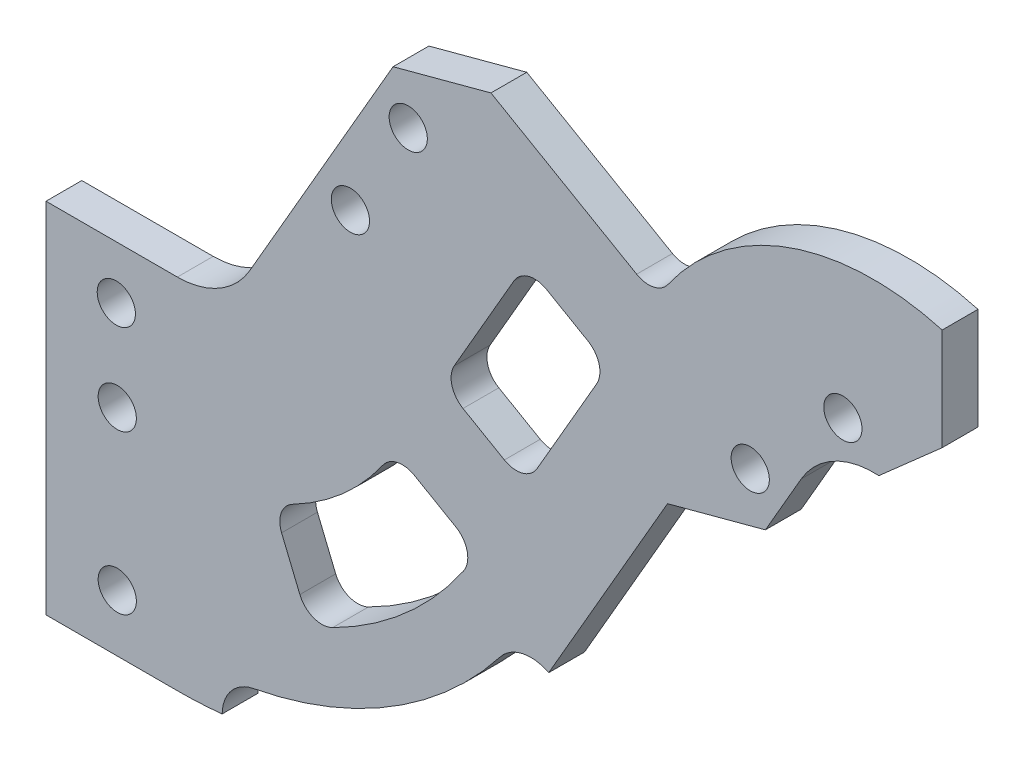
from build123d import *

# Parameters (mm, degrees)
SKETCH1_R          = 1.6
EXTRUDE1_DEPTH     = 3
SKETCH2_R          = 1.6
CUT_EXTRUDE1_DEPTH = 10


with BuildPart() as part:
    # Sketch1 → Extrude1 (new body)
    with BuildSketch(Plane.XY):
        with BuildLine():
            Line((-45.524801784, 28.664626531), (-37.328649362, 30.860778953))
            Line((-37.328649362, 30.860778953), (-25.128844255, 23.817218191))
            ThreePointArc((-25.128844255, 23.817218191), (-23.695769789, 23.596720278), (-22.490310791, 24.402443777))
            ThreePointArc((-22.490310791, 24.402443777), (-12.321299382, 32.147149867), (0.454378412, 32.561060923))
            Line((0.454378412, 32.561060923), (0.454378412, 24.024885934))
            Line((0.454378412, 24.024885934), (-4.848291471, 19.347098838))
            ThreePointArc((-4.848291471, 19.347098838), (-8.594498853, 18.529402179), (-11.347887248, 15.860778953))
            Line((-11.347887248, 15.860778953), (-14.347887248, 10.664626531))
            Line((-14.347887248, 10.664626531), (-22.544039671, 8.468474108))
            Line((-22.544039671, 8.468474108), (-32.494200847, -8.765710592))
            ThreePointArc((-32.494200847, -8.765710592), (-34.686208494, -8.475053996), (-36.556835292, -9.654093507))
            ThreePointArc((-36.556835292, -9.654093507), (-45.724735719, -17.843308487), (-57.193646277, -22.26798145))
            ThreePointArc((-57.193646277, -22.26798145), (-59.080348228, -23.376243821), (-59.836827788, -25.429443375))
            ThreePointArc((-59.836827788, -25.429443375), (-61.709484996, -25.572317511), (-63.586979611, -25.61998316))
            Line((-63.586979611, -25.61998316), (-74.586979611, -25.61998316))
            Line((-74.586979611, -25.61998316), (-74.586979611, 4.38001684))
            Line((-74.586979611, 4.38001684), (-63.586979611, 4.38001684))
            ThreePointArc((-63.586979611, 4.38001684), (-60.086979611, 5.317839013), (-57.524801784, 7.88001684))
            Line((-57.524801784, 7.88001684), (-45.524801784, 28.664626531))
        make_face()
        with Locations((-7.860838428, 22.023527558)):
            Circle(SKETCH1_R, mode=Mode.SUBTRACT)
        with Locations((-15.617536335, 14.465529805)):
            Circle(SKETCH1_R, mode=Mode.SUBTRACT)
        with Locations((-44.255152698, 24.863723257)):
            Circle(SKETCH1_R, mode=Mode.SUBTRACT)
        with Locations((-49.098298448, 16.475148748)):
            Circle(SKETCH1_R, mode=Mode.SUBTRACT)
        with BuildLine():
            Line((-43.743844778, -0.076422397), (-40.268531978, -2.082895178))
            ThreePointArc((-40.268531978, -2.082895178), (-39.318822643, -3.369262792), (-39.615313635, -4.940498787))
            ThreePointArc((-39.615313635, -4.940498787), (-44.486377663, -10.44123439), (-50.583544918, -14.541223219))
            ThreePointArc((-50.583544918, -14.541223219), (-52.180202255, -14.627099929), (-53.329522835, -13.515456253))
            Line((-53.329522835, -13.515456253), (-54.858264001, -9.80510822))
            ThreePointArc((-54.858264001, -9.80510822), (-54.887106697, -8.355456589), (-53.928892503, -7.267271258))
            ThreePointArc((-53.928892503, -7.267271258), (-49.755509235, -4.421578878), (-46.382378242, -0.661647984))
            ThreePointArc((-46.382378242, -0.661647984), (-45.176919243, 0.144075516), (-43.743844778, -0.076422397))
        make_face(mode=Mode.SUBTRACT)
        with BuildLine():
            Line((-33.472242901, 5.540270878), (-28.472242901, 14.200524916))
            ThreePointArc((-28.472242901, 14.200524916), (-28.272442056, 15.718163006), (-29.204293709, 16.932575723))
            Line((-29.204293709, 16.932575723), (-32.668395324, 18.932575723))
            ThreePointArc((-32.668395324, 18.932575723), (-34.186033414, 19.132376568), (-35.400446131, 18.200524916))
            Line((-35.400446131, 18.200524916), (-40.400446131, 9.540270878))
            ThreePointArc((-40.400446131, 9.540270878), (-40.600246976, 8.022632788), (-39.668395324, 6.80822007))
            Line((-39.668395324, 6.80822007), (-36.204293709, 4.80822007))
            ThreePointArc((-36.204293709, 4.80822007), (-34.686655618, 4.608419225), (-33.472242901, 5.540270878))
        make_face(mode=Mode.SUBTRACT)
    extrude(amount=EXTRUDE1_DEPTH)

    # Sketch2 → Cut-Extrude1 (cut)
    with BuildSketch(Plane(origin=(0, 0, 0), x_dir=(-1, 0, 0), z_dir=(0, 0, -1))):
        with Locations((68.700777825, -0.059973733)):
            Circle(SKETCH2_R)
        with Locations((68.620801918, -7.591809129)):
            Circle(SKETCH2_R)
        with Locations((68.620801918, -20.85197665)):
            Circle(SKETCH2_R)
    extrude(amount=-CUT_EXTRUDE1_DEPTH, mode=Mode.SUBTRACT)


solid = part.part
